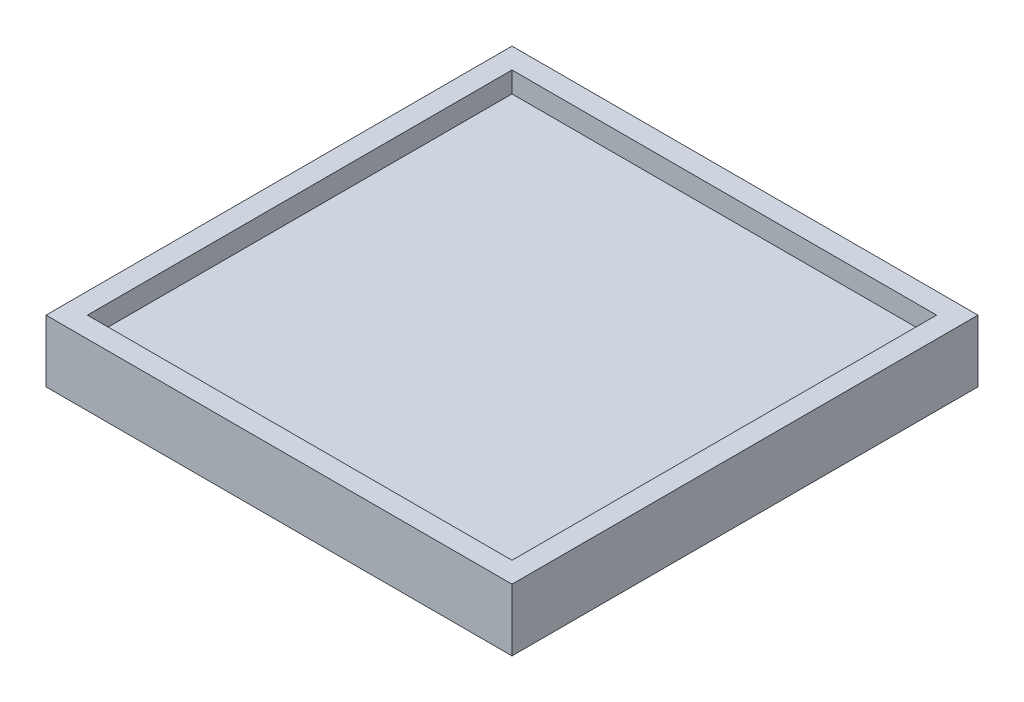
from build123d import *

# Parameters (mm, degrees)
SKETCH1_W           = 225
SKETCH1_H           = 225
SKETCH1_W_2         = 205
SKETCH1_H_2         = 205
WALLS_DEPTH         = 30
SKETCH1_5_W         = 205
SKETCH1_5_H         = 205
BOSS_EXTRUDE2_DEPTH = 20


with BuildPart() as part:
    # Sketch1 → Walls (new body)
    with BuildSketch(Plane(origin=(0, 0, 0), x_dir=(1, 0, 0), z_dir=(0, 1, 0))):
        with Locations((-20.5, -12.5)):
            Rectangle(SKETCH1_W, SKETCH1_H)
        with Locations((-20.5, -12.5)):
            Rectangle(SKETCH1_W_2, SKETCH1_H_2, mode=Mode.SUBTRACT)
    extrude(amount=WALLS_DEPTH)

    # Sketch1<5> → Boss-Extrude2 (add)
    with BuildSketch(Plane(origin=(0, 0, 0), x_dir=(1, 0, 0), z_dir=(0, 1, 0))):
        with Locations((-20.5, -12.5)):
            Rectangle(SKETCH1_5_W, SKETCH1_5_H)
    extrude(amount=BOSS_EXTRUDE2_DEPTH)


solid = part.part
